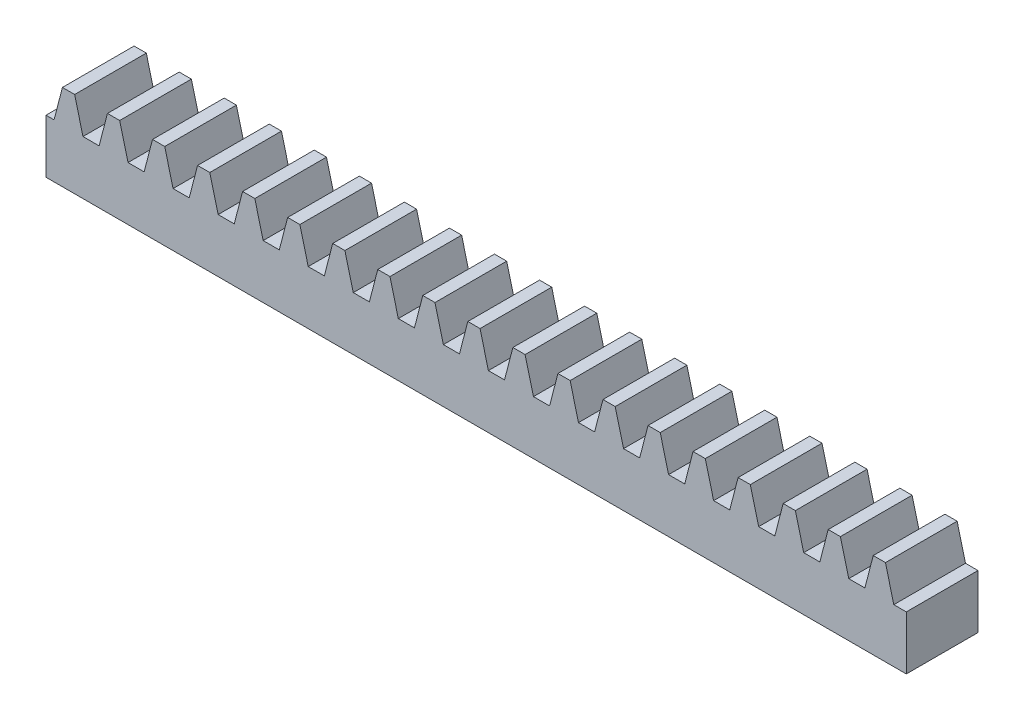
from build123d import *

# Parameters (mm, degrees)
BLANKSKE_W        = 120
BLANKSKE_H        = 12
BLANK_DEPTH       = 10
TOOTHCUTSIM_DEPTH = 122.012396059
TEETHCUTS_COUNT   = 21
TEETHCUTS_PITCH   = 6.2831853


with BuildPart() as part:
    # BlankSke → Blank (new body)
    with BuildSketch(Plane.XY):
        with Locations((60, 6)):
            Rectangle(BLANKSKE_W, BLANKSKE_H)
    extrude(amount=-BLANK_DEPTH)

    # TooCutSkeSim → ToothCutSim (cut, through all)
    with BuildSketch(Plane.XY):
        Polygon((1.125252364, 7.5), (-1.125252364, 7.5), (-2.29560038, 12.0254), (2.29560038, 12.0254), align=None)
    toothcutsim = extrude(amount=-TOOTHCUTSIM_DEPTH, mode=Mode.SUBTRACT)

    # TeethCuts: ToothCutSim ×21
    with Locations(*[(i * TEETHCUTS_PITCH, 0, 0) for i in range(1, TEETHCUTS_COUNT)]):
        add(toothcutsim, mode=Mode.SUBTRACT)


solid = part.part
